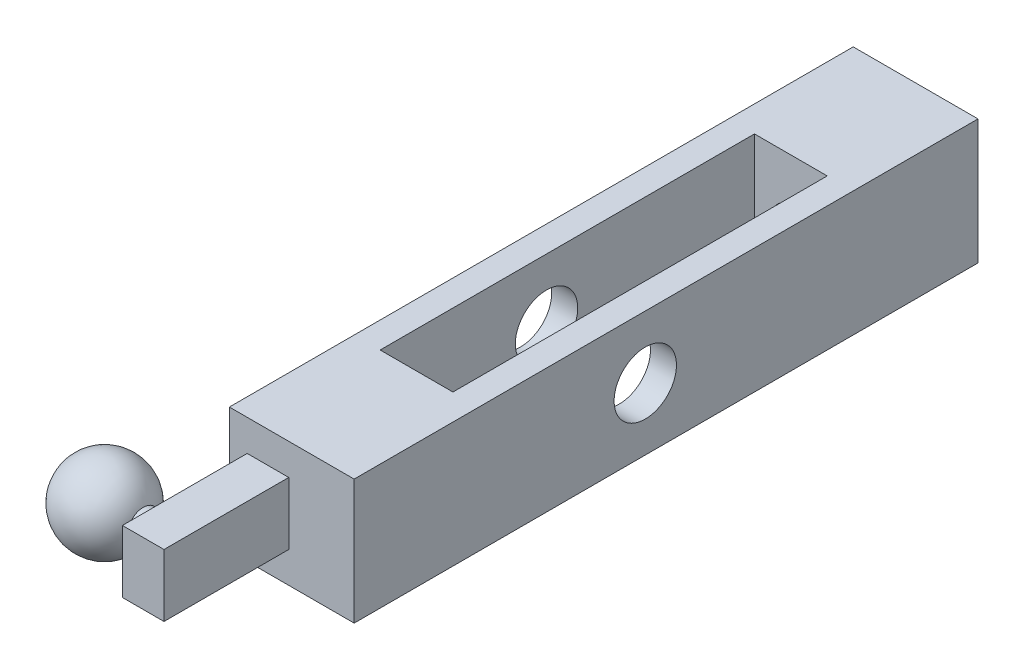
from build123d import *

# Parameters (mm, degrees)
SKETCH_1_W          = 6
SKETCH_1_H          = 6
EXTRUDE_1_DEPTH     = 30
SKETCH_2_W          = 2
SKETCH_2_H          = 3
EXTRUDE_2_DEPTH     = 6
SKETCH_3_R          = 0.75
EXTRUDE_3_DEPTH     = 1
SKETCH_5_W          = 18
SKETCH_5_H          = 3.5
CUT_EXTRUDE_1_DEPTH = 8
SKETCH_6_R          = 1.5
CUT_EXTRUDE_2_DEPTH = 8
SKETCH_7_R          = 0.9
CUT_EXTRUDE_3_DEPTH = 8


with BuildPart() as part:
    # 草图1 → 凸台-拉伸1 (new body)
    with BuildSketch(Plane.XY):
        Rectangle(SKETCH_1_W, SKETCH_1_H)
    extrude(amount=EXTRUDE_1_DEPTH)

    # 草图2 → 凸台-拉伸2 (add)
    with BuildSketch(Plane.XY.offset(30)):
        with Locations((-1.14479355, -0.004540815)):
            Rectangle(SKETCH_2_W, SKETCH_2_H)
    extrude(amount=EXTRUDE_2_DEPTH)

    # 草图3 → 凸台-拉伸3 (add)
    with BuildSketch(Plane.ZY.offset(2.14479355)):
        with Locations(Location((34, 0, 0), (0, 0, 90))):
            Circle(SKETCH_3_R)
    extrude(amount=EXTRUDE_3_DEPTH)

    # 草图4 → 旋转1 (revolve)
    with BuildSketch(Plane(origin=(0, 0, 0), x_dir=(1, 0, 0), z_dir=(0, 1, 0))):
        with BuildLine():
            Line((-3.14479355, -34), (-6.998843172, -34))
            ThreePointArc((-6.998843172, -34), (-5.380877697, -32.036826645), (-3.14479355, -33.25))
            Line((-3.14479355, -33.25), (-3.14479355, -34))
        make_face()
    revolve(axis=Axis((-3.14479355, 0, 34), (-1, 0, 0)))

    # 草图5 → 切除-拉伸1 (cut)
    with BuildSketch(Plane(origin=(0.5, 3, 0), x_dir=(0, 0, 1), z_dir=(0, -1, 0))):
        with Locations((15, 0.5)):
            Rectangle(SKETCH_5_W, SKETCH_5_H)
    extrude(amount=CUT_EXTRUDE_1_DEPTH, mode=Mode.SUBTRACT)

    # 草图6 → 切除-拉伸2 (cut)
    with BuildSketch(Plane.ZY.offset(3)):
        with Locations((16, 0)):
            Circle(SKETCH_6_R)
    extrude(amount=-CUT_EXTRUDE_2_DEPTH, mode=Mode.SUBTRACT)

    # 草图7 → 切除-拉伸3 (cut)
    with BuildSketch(Plane(origin=(0, 0, 0), x_dir=(-1, 0, 0), z_dir=(0, 0, -1))):
        Circle(SKETCH_7_R)
    extrude(amount=-CUT_EXTRUDE_3_DEPTH, mode=Mode.SUBTRACT)


solid = part.part
